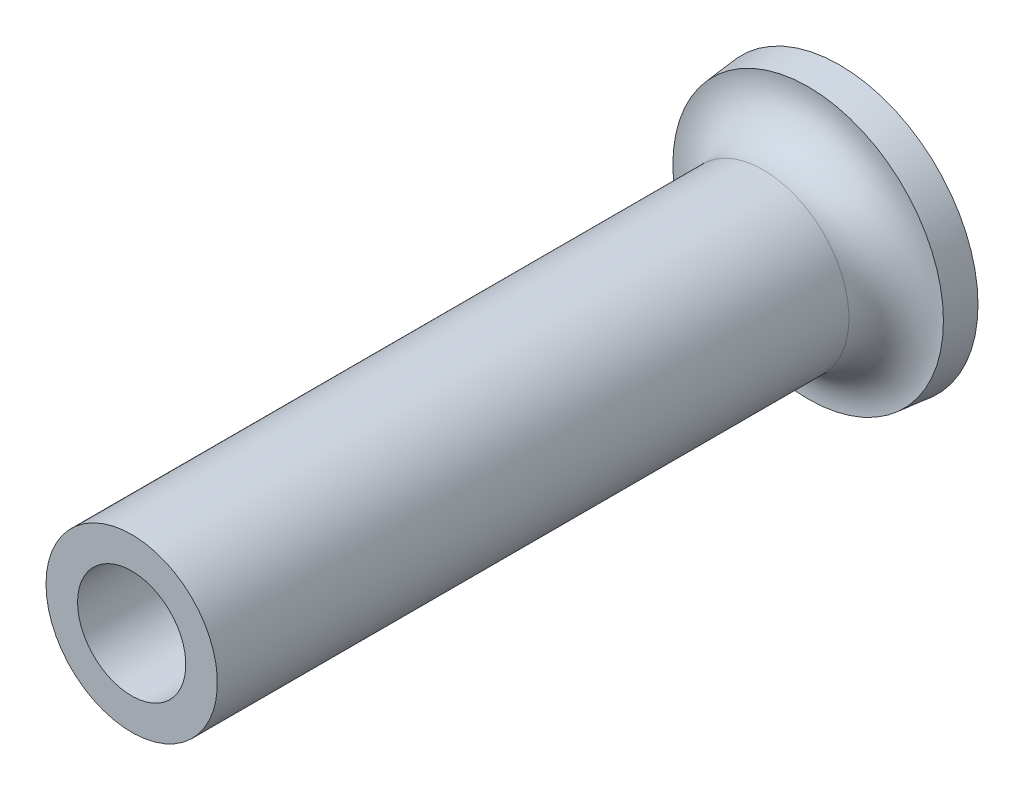
from build123d import *


with BuildPart() as part:
    # Sketch1 → Revolve-Thin1 (revolve)
    with BuildSketch(Plane(origin=(0, 0, 0), x_dir=(0, 0, -1), z_dir=(1, 0, 0)), mode=Mode.PRIVATE) as revolve_thin1_sk:
        with BuildLine():
            ThreePointArc((0.994987437, 3), (0.741619849, 2.229179607), (0, 1.9))
            Line((0, 1.9), (-14.005012563, 1.9))
            Line((-14.005012563, 1.9), (-14.005012563, 1.2))
            Line((-14.005012563, 1.2), (0, 1.2))
            ThreePointArc((0, 1.2), (1.260753743, 1.759605331), (1.691478643, 3.07))
            Line((1.691478643, 3.07), (0.994987437, 3))
        make_face()
    revolve(revolve_thin1_sk.sketch.rotate(Axis((0, 0, 0), (0, 0, 1)), 90), axis=Axis((0, 0, 0), (0, 0, 1)))


solid = part.part
